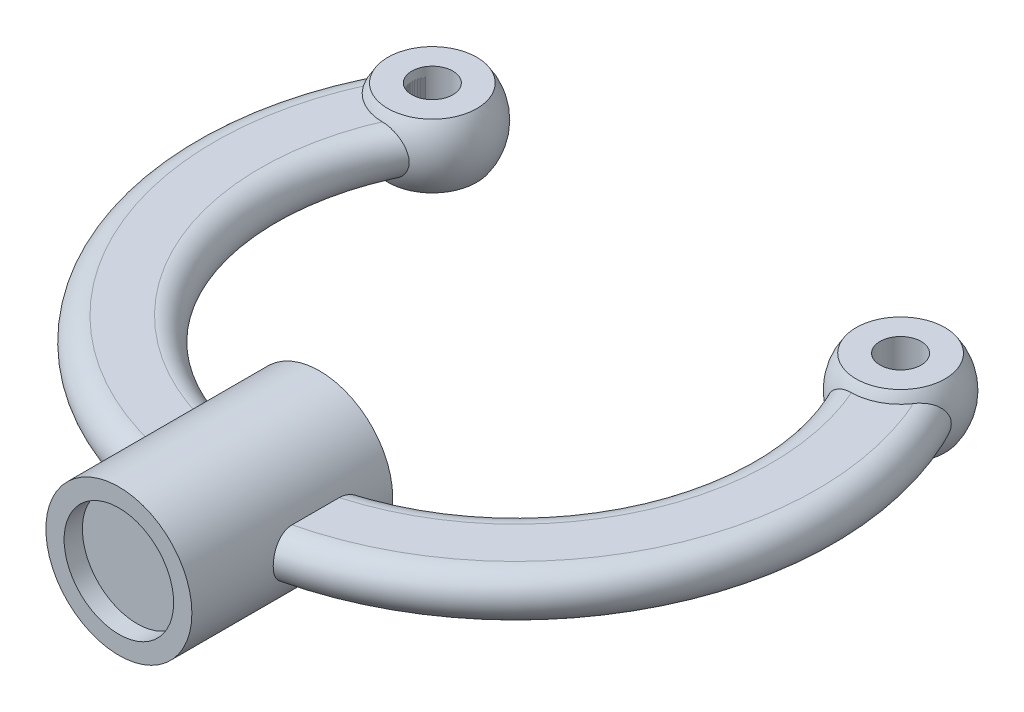
from build123d import *

# Parameters (mm, degrees)
SKETCH7_W                = 138.667181603
SKETCH7_H                = 62.252300273
CUT_EXTRUDE4_DEPTH       = 156.470254523
SKETCH8_W                = 150.818962898
SKETCH8_H                = 56.532407254
CUT_EXTRUDE5_DEPTH       = 156.470254523
SKETCH12_R               = 4.5
CUT_EXTRUDE6_DEPTH       = 156.470254523
CUT_EXTRUDE7_DEPTH       = 155.770798414
CUT_EXTRUDE7_DEPTH_BACK  = 155.770798414
BOSS_EXTRUDE2_DEPTH      = 21
BOSS_EXTRUDE2_DEPTH_BACK = 23
SKETCH14_R               = 16
SKETCH16_R               = 12
CUT_EXTRUDE8_DEPTH       = 151.734866628
SKETCH17_W               = 14
SKETCH17_H               = 2


with BuildPart() as part:
    # Sketch1 → Revolve1 (revolve)
    with BuildSketch(Plane(origin=(0, 0, 0), x_dir=(0, 0, -1), z_dir=(1, 0, 0))):
        with BuildLine():
            Line((0, 5), (10, 5))
            ThreePointArc((10, 5), (15, 0), (10, -5))
            Line((10, -5), (0, -5))
            ThreePointArc((0, -5), (-5, 0), (0, 5))
        make_face()
    revolve(axis=Axis((0, 16.0008336, -66), (0, -1, 0)))


with BuildPart() as body_2:
    # Sketch2 → Revolve2 (revolve)
    with BuildSketch(Plane(origin=(0, 0, 0), x_dir=(1, 0, 0), z_dir=(0, 1, 0))):
        with BuildLine():
            Line((-61.395418997, 105.491803279), (-41.21062371, 92.508196721))
            ThreePointArc((-41.21062371, 92.508196721), (-57.794824632, 88.907602357), (-61.395418997, 105.491803279))
        make_face()
    revolve(axis=Axis((-51.303021354, 0, -99), (-0.841033136942994, 0, -0.5409836065573772)))


with BuildPart() as body_3:
    # Sketch9 → Revolve4 (revolve)
    with BuildSketch(Plane(origin=(0, 0, 0), x_dir=(1, 0, 0), z_dir=(0, 1, 0))):
        with BuildLine():
            Line((39.303021354, 99), (63.303021354, 99))
            ThreePointArc((63.303021354, 99), (51.303021354, 111), (39.303021354, 99))
        make_face()
    revolve(axis=Axis((39.303021354, 0, -99), (1, 0, 0)))


with BuildPart() as cut_extrude4_tool:
    # Sketch7 → Cut-Extrude4 (new, through all)
    with BuildSketch(Plane(origin=(0, 7, 0), x_dir=(1, 0, 0), z_dir=(0, 1, 0))):
        with Locations((-1.666409198, 97.126150137)):
            Rectangle(SKETCH7_W, SKETCH7_H)
    extrude(amount=CUT_EXTRUDE4_DEPTH)


with BuildPart() as body_2_1:
    add(body_2.part)

    # Cut-Extrude4: cut by cut_extrude4_tool
    add(cut_extrude4_tool.part, mode=Mode.SUBTRACT)


with BuildPart() as body_3_1:
    add(body_3.part)

    # Cut-Extrude4: cut by cut_extrude4_tool
    add(cut_extrude4_tool.part, mode=Mode.SUBTRACT)


with BuildPart() as cut_extrude5_tool:
    # Sketch8 → Cut-Extrude5 (new, through all)
    with BuildSketch(Plane(origin=(0, -7, 0), x_dir=(-1, 0, 0), z_dir=(0, -1, 0))):
        with Locations((5.180962211, 94.961669782)):
            Rectangle(SKETCH8_W, SKETCH8_H)
    extrude(amount=CUT_EXTRUDE5_DEPTH)


with BuildPart() as body_2_2:
    add(body_2_1.part)

    # Cut-Extrude5: cut by cut_extrude5_tool
    add(cut_extrude5_tool.part, mode=Mode.SUBTRACT)


with BuildPart() as body_3_2:
    add(body_3_1.part)

    # Cut-Extrude5: cut by cut_extrude5_tool
    add(cut_extrude5_tool.part, mode=Mode.SUBTRACT)


with BuildPart() as cut_extrude6_tool:
    # Sketch12 → Cut-Extrude6 (new, through all)
    with BuildSketch(Plane(origin=(0, 7, 0), x_dir=(1, 0, 0), z_dir=(0, 1, 0))):
        with Locations(Location((-51.303021354, 99, 0), (0, 0, 270))):
            Circle(SKETCH12_R)
        with Locations(Location((51.303021354, 99, 0), (0, 0, 270))):
            Circle(SKETCH12_R)
    extrude(amount=-CUT_EXTRUDE6_DEPTH)


with BuildPart() as part_1:
    add(part.part)

    # Cut-Extrude6: cut by cut_extrude6_tool
    add(cut_extrude6_tool.part, mode=Mode.SUBTRACT)

    # Sketch13 → Cut-Extrude7 (cut, two sides: drawn at the far end of the back side and taken through both)
    with BuildSketch(Plane(origin=(0, 0, 0), x_dir=(1, 0, 0), z_dir=(0, 1, 0)).offset(-CUT_EXTRUDE7_DEPTH_BACK)):
        Polygon((0, 66), (-51.303021354, 99), (-118.585672309, 142.278688525), (118.585672309, 142.278688525), (51.303021354, 99), align=None)
    extrude(amount=CUT_EXTRUDE7_DEPTH + CUT_EXTRUDE7_DEPTH_BACK, mode=Mode.SUBTRACT)

    # Sketch14 → Boss-Extrude2 (add, two sides: drawn at the far end of the back side and taken through both)
    with BuildSketch(Plane.XY.offset(-BOSS_EXTRUDE2_DEPTH_BACK)):
        Circle(SKETCH14_R)
    extrude(amount=BOSS_EXTRUDE2_DEPTH + BOSS_EXTRUDE2_DEPTH_BACK)

    # Sketch16 → Cut-Extrude8 (cut, through all)
    with BuildSketch(Plane.XY.offset(21)):
        Circle(SKETCH16_R)
    extrude(amount=-CUT_EXTRUDE8_DEPTH, mode=Mode.SUBTRACT)

    # Sketch17 → Revolve5 (revolve)
    with BuildSketch(Plane(origin=(0, 0, 0), x_dir=(1, 0, 0), z_dir=(0, 1, 0)), mode=Mode.PRIVATE) as revolve5_sk:
        with Locations((-7, -16)):
            Rectangle(SKETCH17_W, SKETCH17_H)
    revolve(revolve5_sk.sketch.rotate(Axis((0, 0, 0), (0, 0, 1)), 180), axis=Axis((0, 0, 0), (0, 0, 1)))


with BuildPart() as body_2_3:
    add(body_2_2.part)

    # Cut-Extrude6: cut by cut_extrude6_tool
    add(cut_extrude6_tool.part, mode=Mode.SUBTRACT)


with BuildPart() as body_3_3:
    add(body_3_2.part)

    # Cut-Extrude6: cut by cut_extrude6_tool
    add(cut_extrude6_tool.part, mode=Mode.SUBTRACT)


solid = Compound([part_1.part, body_2_3.part, body_3_3.part])
